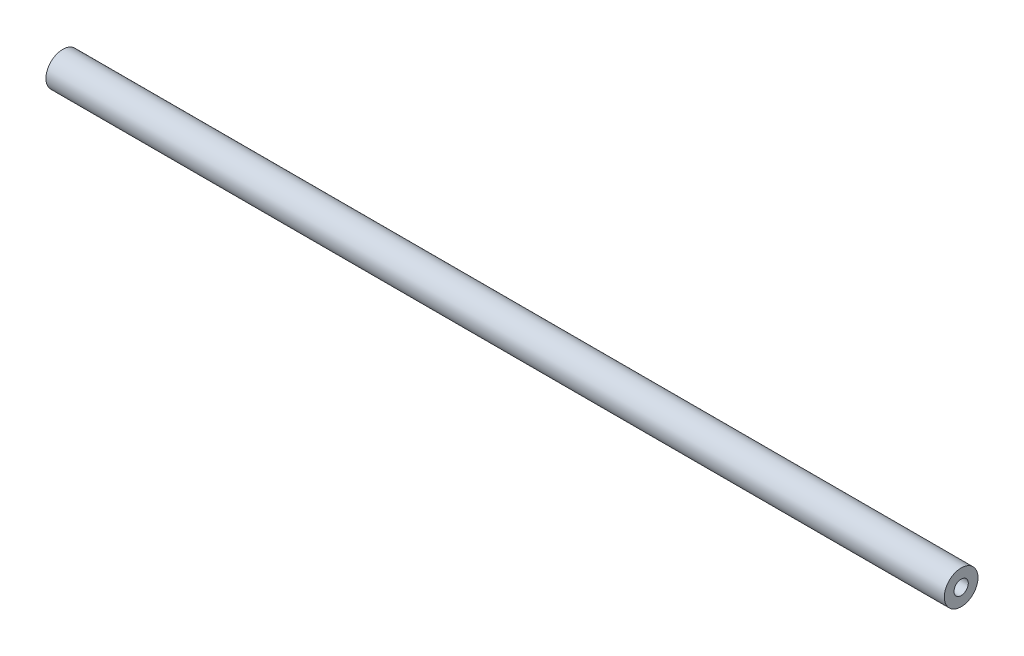
from build123d import *

# Parameters (mm, degrees)
SKETCH1_R                            = 4.7625
BOSS_EXTRUDE1_DEPTH                  = 127
F_10_32_TAPPED_HOLE1_D               = 4.0386
F_10_32_TAPPED_HOLE1_DEPTH           = 12.02944
F_10_32_TAPPED_HOLE1_TIP             = 1.213317848
F_10_32_TAPPED_HOLE1_ON_FACE_2_D     = 4.0386
F_10_32_TAPPED_HOLE1_ON_FACE_2_DEPTH = 12.02944
F_10_32_TAPPED_HOLE1_ON_FACE_2_TIP   = 1.213317848


with BuildPart() as part:
    # Sketch1 → Boss-Extrude1 (new, symmetric)
    with BuildSketch(Plane(origin=(0, 0, 0), x_dir=(0, 0, -1), z_dir=(1, 0, 0))):
        Circle(SKETCH1_R)
    extrude(amount=BOSS_EXTRUDE1_DEPTH, both=True)

    # #10-32 Tapped Hole1
    with Locations(Plane(origin=(127, 0, 0), x_dir=(0, 0, 1), z_dir=(1, 0, 0))):
        with Locations((0, 0)):
            Hole(F_10_32_TAPPED_HOLE1_D / 2, depth=F_10_32_TAPPED_HOLE1_DEPTH)
            with Locations((0, 0, -(F_10_32_TAPPED_HOLE1_DEPTH + F_10_32_TAPPED_HOLE1_TIP / 2))):  # 118° drill point
                Cone(0, F_10_32_TAPPED_HOLE1_D / 2, F_10_32_TAPPED_HOLE1_TIP, mode=Mode.SUBTRACT)

    # #10-32 Tapped Hole1 on face 2
    with Locations(Plane(origin=(-127, 0, 0), x_dir=(0, 0, -1), z_dir=(-1, 0, 0))):
        with Locations((0, 0)):
            Hole(F_10_32_TAPPED_HOLE1_ON_FACE_2_D / 2, depth=F_10_32_TAPPED_HOLE1_ON_FACE_2_DEPTH)
            with Locations((0, 0, -(F_10_32_TAPPED_HOLE1_ON_FACE_2_DEPTH + F_10_32_TAPPED_HOLE1_ON_FACE_2_TIP / 2))):  # 118° drill point
                Cone(0, F_10_32_TAPPED_HOLE1_ON_FACE_2_D / 2, F_10_32_TAPPED_HOLE1_ON_FACE_2_TIP, mode=Mode.SUBTRACT)


solid = part.part
